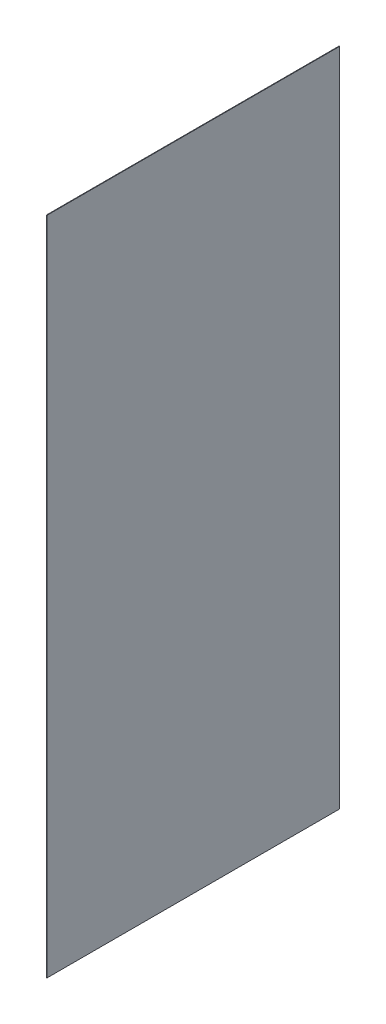
from build123d import *

# Parameters (mm, degrees)
SKETCH1_W                 = 1.5
SKETCH1_H                 = 1850
PRESS_DIS_YAN_SAG_1_DEPTH = 820


with BuildPart() as part:
    # Sketch1 → PRESS_dis_yan_sag_1 (new body)
    with BuildSketch(Plane.XY):
        with Locations((699.25, 1045)):
            Rectangle(SKETCH1_W, SKETCH1_H)
    extrude(amount=-PRESS_DIS_YAN_SAG_1_DEPTH)


solid = part.part
